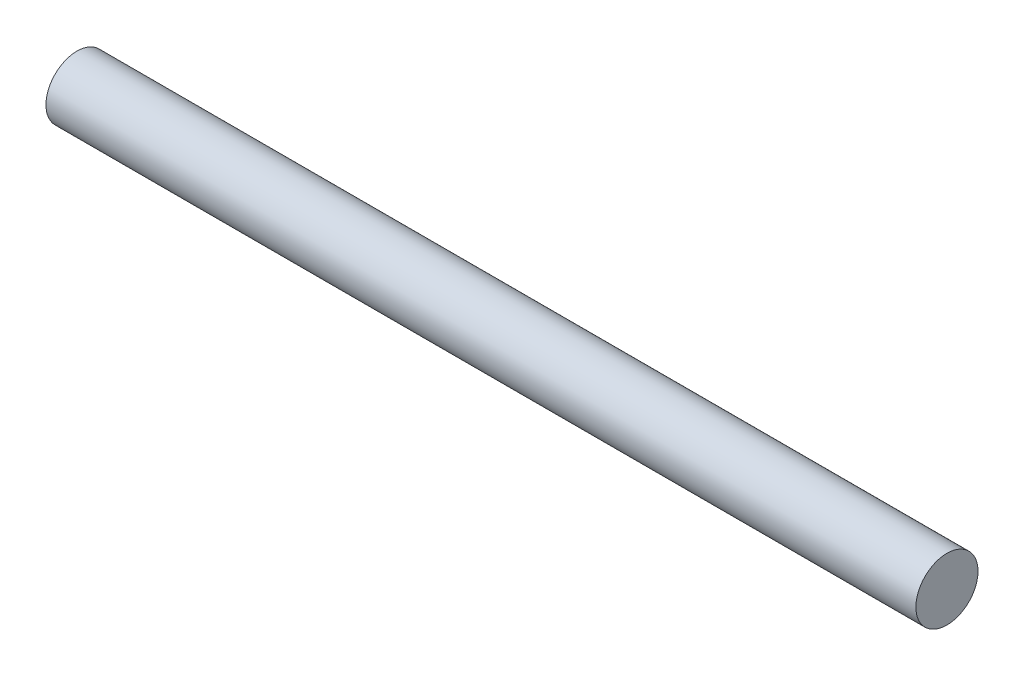
from build123d import *

# Parameters (mm, degrees)
SKETCH1_R           = 2.5
BOSS_EXTRUDE1_DEPTH = 70


with BuildPart() as part:
    # Sketch1 → Boss-Extrude1 (new body)
    with BuildSketch(Plane(origin=(0, 0, 0), x_dir=(0, 0, -1), z_dir=(1, 0, 0))):
        Circle(SKETCH1_R)
    extrude(amount=BOSS_EXTRUDE1_DEPTH)


solid = part.part
